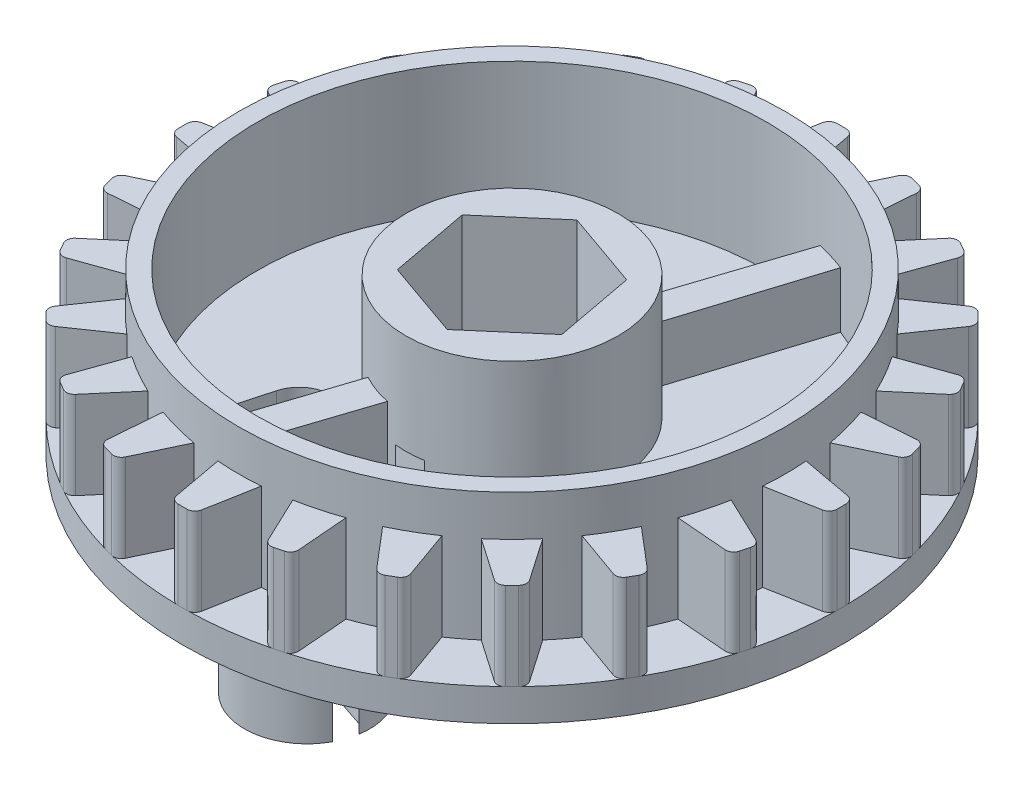
from build123d import *

# Parameters (mm, degrees)
SKETCH2_R            = 10.25
BOSS_EXTRUDE3_DEPTH  = 1
SKETCH3_R            = 8.5
SKETCH3_R_2          = 7.925
BOSS_EXTRUDE4_DEPTH  = 4
SKETCH4_R            = 3.3
BOSS_EXTRUDE6_DEPTH  = 3.85
CUT_EXTRUDE5_DEPTH   = 16.333786225
BOSS_EXTRUDE9_DEPTH  = 2.73
CIRPATTERN1_COUNT    = 24
BOSS_EXTRUDE17_DEPTH = 4.88
CUT_EXTRUDE27_START  = -1.74
CUT_EXTRUDE27_DEPTH  = 1.74
BOSS_EXTRUDE21_DEPTH = 1.74
BOSS_EXTRUDE25_DEPTH = 1.74


with BuildPart() as part:
    # Sketch2 → Boss-Extrude3 (new body)
    with BuildSketch(Plane(origin=(0, 0, 0), x_dir=(1, 0, 0), z_dir=(0, 1, 0))):
        with Locations(Location((0, 0, 0), (0, 0, 270))):
            Circle(SKETCH2_R)
    extrude(amount=BOSS_EXTRUDE3_DEPTH)

    # Sketch3 → Boss-Extrude4 (add)
    with BuildSketch(Plane(origin=(0, 1, 0), x_dir=(1, 0, 0), z_dir=(0, 1, 0))):
        with Locations(Location((0, 0, 0), (0, 0, 270))):
            Circle(SKETCH3_R)
        with Locations(Location((0, 0, 0), (0, 0, 270))):
            Circle(SKETCH3_R_2, mode=Mode.SUBTRACT)
    extrude(amount=BOSS_EXTRUDE4_DEPTH)

    # Sketch4 → Boss-Extrude6 (add)
    with BuildSketch(Plane(origin=(0, 1, 0), x_dir=(1, 0, 0), z_dir=(0, 1, 0))):
        with Locations(Location((0, 0, 0), (0, 0, 90))):
            Circle(SKETCH4_R)
    extrude(amount=BOSS_EXTRUDE6_DEPTH)

    # Sketch5 → Cut-Extrude5 (cut, through all)
    with BuildSketch(Plane.XZ):
        Polygon((0.467435328, 2.485217136), (-1.91854351, 1.647419437), (-2.385978838, -0.8377977), (-0.467435328, -2.485217136), (1.91854351, -1.647419437), (2.385978838, 0.8377977), align=None)
    extrude(amount=-CUT_EXTRUDE5_DEPTH, mode=Mode.SUBTRACT)

    # Sketch9 → Boss-Extrude9 (add)
    with BuildSketch(Plane(origin=(0, 1, 0), x_dir=(1, 0, 0), z_dir=(0, 1, 0))):
        with BuildLine():
            Line((0.68, 8.45), (-0.68, 8.45))
            Line((-0.68, 8.45), (-0.387568306, 10.045081967))
            ThreePointArc((-0.387568306, 10.045081967), (-0.301712767, 10.19205532), (-0.141666667, 10.25))
            Line((-0.141666667, 10.25), (0.141666667, 10.25))
            ThreePointArc((0.141666667, 10.25), (0.301712767, 10.19205532), (0.387568306, 10.045081967))
            Line((0.387568306, 10.045081967), (0.68, 8.45))
        make_face()
    boss_extrude9 = extrude(amount=BOSS_EXTRUDE9_DEPTH)

    # CirPattern1: Boss-Extrude9 ×24 about axis
    cirpattern1_axis = Axis((0, 0, 0), (0, 1, 0))
    for i in range(1, CIRPATTERN1_COUNT):
        add(boss_extrude9.rotate(cirpattern1_axis, i * 360 / CIRPATTERN1_COUNT))

    # Sketch13 → Boss-Extrude17 (add)
    with BuildSketch(Plane(origin=(0, 0, 0), x_dir=(-1, 0, 0), z_dir=(0, -1, 0))):
        with BuildLine():
            Line((-0.034847715, -4.762502267), (0.78670061, -4.486492134))
            ThreePointArc((0.78670061, -4.486492134), (1.369892597, -3.864482211), (2.210341375, -4.008201004))
            Line((2.210341375, -4.008201004), (3.1099158, -3.70597696))
            ThreePointArc((3.1099158, -3.70597696), (3.236138045, -3.697342525), (3.35042459, -3.751612169))
            ThreePointArc((3.35042459, -3.751612169), (1.005777066, -2.879405514), (-0.267890518, -5.032516599))
            ThreePointArc((-0.267890518, -5.032516599), (-0.188344512, -4.865596868), (-0.034847715, -4.762502267))
        make_face()
        with BuildLine():
            Line((1.110104032, -5.432767625), (0.283622943, -5.710434986))
            ThreePointArc((0.283622943, -5.710434986), (0.100879603, -5.721323619), (-0.062363253, -5.638465544))
            ThreePointArc((-0.062363253, -5.638465544), (2.131218774, -6.608959137), (3.60651619, -4.717621659))
            ThreePointArc((3.60651619, -4.717621659), (3.602772678, -4.596850459), (3.591556515, -4.476542961))
            ThreePointArc((3.591556515, -4.476542961), (3.532755333, -4.586186517), (3.428386459, -4.653909679))
            Line((3.428386459, -4.653909679), (2.523879269, -4.957790951))
            ThreePointArc((2.523879269, -4.957790951), (1.943139782, -5.570761106), (1.110104032, -5.432767625))
        make_face()
    extrude(amount=BOSS_EXTRUDE17_DEPTH)

    # Sketch16 → Cut-Extrude27 (cut)
    with BuildSketch(Plane.XZ.offset(CUT_EXTRUDE27_START)):
        with BuildLine():
            ThreePointArc((-3.591556515, 4.476542961), (-3.298766179, 5.76905638), (-2.247445462, 6.575928037))
            Line((-2.247445462, 6.575928037), (-4.205256732, 6.035701902))
            ThreePointArc((-4.205256732, 6.035701902), (-4.808982331, 5.565274608), (-4.903238466, 4.805733813))
            Line((-4.903238466, 4.805733813), (-4.386676708, 2.933683636))
            ThreePointArc((-4.386676708, 2.933683636), (-3.916249414, 2.329958037), (-3.156708619, 2.235701902))
            Line((-3.156708619, 2.235701902), (0.789092995, 3.324481596))
            ThreePointArc((0.789092995, 3.324481596), (1.392818594, 3.79490889), (1.487074729, 4.554449684))
            Line((1.487074729, 4.554449684), (0.970512971, 6.426499862))
            ThreePointArc((0.970512971, 6.426499862), (0.500085677, 7.03022546), (-0.259455118, 7.124481596))
            Line((-0.259455118, 7.124481596), (-2.102185674, 6.616010109))
            ThreePointArc((-2.102185674, 6.616010109), (-0.853917757, 6.494792375), (0.062363253, 5.638465544))
            ThreePointArc((0.062363253, 5.638465544), (0.190150273, 5.343978566), (0.267890518, 5.032516599))
            ThreePointArc((0.267890518, 5.032516599), (0.287074955, 4.875588301), (0.29348381, 4.717621659))
            ThreePointArc((0.29348381, 4.717621659), (-1.156826976, 2.832731558), (-3.35042459, 3.751612169))
            ThreePointArc((-3.35042459, 3.751612169), (-3.506840047, 4.102153037), (-3.591556515, 4.476542961))
        make_face()
    extrude(amount=CUT_EXTRUDE27_DEPTH, mode=Mode.SUBTRACT)

    # Sketch17 → Boss-Extrude21 (add)
    with BuildSketch(Plane(origin=(0, 1, 0), x_dir=(1, 0, 0), z_dir=(0, 1, 0))):
        with BuildLine():
            Line((-0.599825221, -3.12785644), (-1.560519146, -2.811438173))
            Line((-1.560519146, -2.811438173), (-3.044454955, -7.316892716))
            ThreePointArc((-3.044454955, -7.316892716), (-2.809488562, -7.410290076), (-2.571662282, -7.496144216))
            Line((-2.571662282, -7.496144216), (-2.083761031, -7.633310983))
            Line((-2.083761031, -7.633310983), (-0.599825221, -3.12785644))
        make_face()
    extrude(amount=BOSS_EXTRUDE21_DEPTH)

    # Sketch18 → Boss-Extrude25 (add)
    with BuildSketch(Plane(origin=(0, 1, 0), x_dir=(1, 0, 0), z_dir=(0, 1, 0))):
        Polygon((2.809488562, 7.410290076), (1.370269971, 2.853651842), (0.382006575, 3.086365005), (1.899587481, 7.693971172), (2.041114069, 7.941859303), (2.809488562, 7.693971172), align=None)
    extrude(amount=BOSS_EXTRUDE25_DEPTH)


solid = part.part
